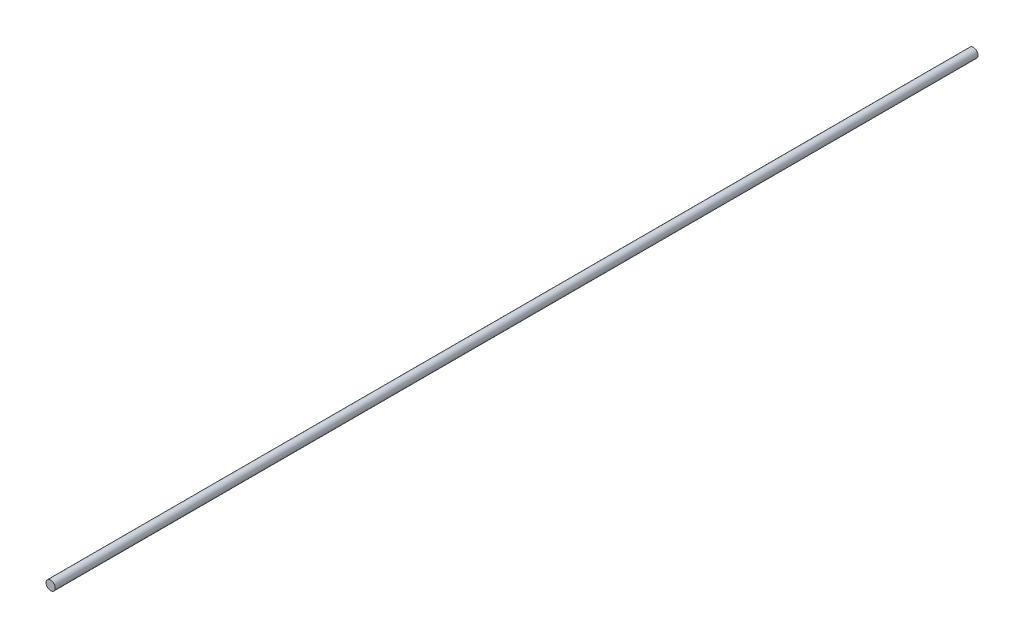
from build123d import *

# Parameters (mm, degrees)
SKETCH1_R           = 7.5
BOSS_EXTRUDE1_DEPTH = 1500


with BuildPart() as part:
    # Sketch1 → Boss-Extrude1 (new body)
    with BuildSketch(Plane.XY):
        Circle(SKETCH1_R)
    extrude(amount=BOSS_EXTRUDE1_DEPTH)


solid = part.part
